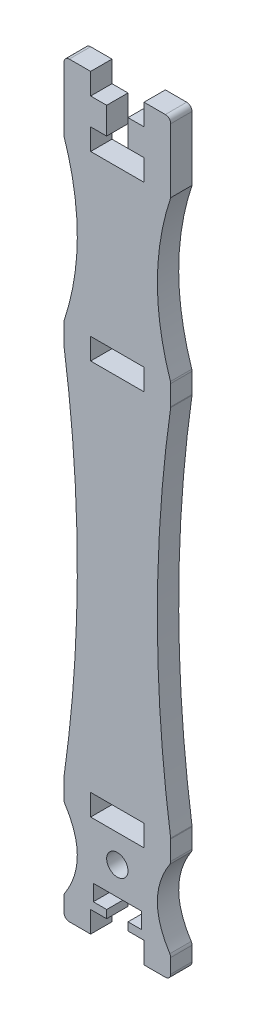
from build123d import *

# Parameters (mm, degrees)
CROQUIS1_W              = 10
CROQUIS1_H              = 4
CROQUIS1_R              = 2
SALIENTE_EXTRUIR1_DEPTH = 4


with BuildPart() as part:
    # Croquis1 → Saliente-Extruir1 (new body)
    with BuildSketch(Plane.XY):
        with BuildLine():
            Line((-14, -70), (-10, -70))
            Line((-10, -70), (-10, -66))
            Line((-10, -66), (-7, -66))
            Line((-7, -66), (-7, -64.5))
            Line((-7, -64.5), (-9.5, -64.5))
            Line((-9.5, -64.5), (-9.5, -61.5))
            Line((-9.5, -61.5), (-0.5, -61.5))
            Line((-0.5, -61.5), (-0.5, -64.5))
            Line((-0.5, -64.5), (-3, -64.5))
            Line((-3, -64.5), (-3, -66))
            Line((-3, -66), (0, -66))
            Line((0, -66), (0, -70))
            Line((0, -70), (4, -70))
            ThreePointArc((4, -70), (4.707106781, -69.707106781), (5, -69))
            Line((5, -69), (5, -66.298618771))
            ThreePointArc((5, -66.298618771), (4.959256868, -66.016083354), (4.840347477, -65.756570693))
            add(Edge.make_bspline(
                [(4.840347477, -65.756570693), (3.280115826, -63.337713796), (1.719884174, -58.5), (3.280115826, -53.662286204), (4.840347477, -51.243429307)],
                knots=[0.01622862, 0.01622862, 0.01622862, 0.01622862, 0.5, 0.98377138, 0.98377138, 0.98377138, 0.98377138], degree=3))
            ThreePointArc((4.840347477, -51.243429307), (4.959256868, -50.983916646), (5, -50.701381229))
            Line((5, -50.701381229), (5, -47.070997241))
            ThreePointArc((5, -47.070997241), (4.997494145, -47.000248166), (4.989989137, -46.929853666))
            add(Edge.make_bspline(
                [(4.989989137, -46.929853666), (3.329996379, -35.286569111), (1.670003621, -12), (3.329996379, 11.286569111), (4.989989137, 22.929853666)],
                knots=[0.00100209, 0.00100209, 0.00100209, 0.00100209, 0.5, 0.99899791, 0.99899791, 0.99899791, 0.99899791], degree=3))
            ThreePointArc((4.989989137, 22.929853666), (4.997494145, 23.000248166), (5, 23.070997241))
            Line((5, 23.070997241), (5, 26.838505544))
            ThreePointArc((5, 26.838505544), (4.987329796, 26.997187218), (4.949640253, 27.151847833))
            add(Edge.make_bspline(
                [(4.949640253, 27.151847833), (1.666752066, 37.101231889), (1.683538525, 47.056062614), (5, 57)],
                knots=[0.005061594, 0.005061594, 0.005061594, 0.005061594, 1, 1, 1, 1], degree=3))
            Line((5, 57), (5, 69))
            ThreePointArc((5, 69), (4.707106781, 69.707106781), (4, 70))
            Line((4, 70), (0, 70))
            Line((0, 70), (0, 66))
            Line((0, 66), (-3, 66))
            Line((-3, 66), (-3, 61))
            Line((-3, 61), (0, 61))
            Line((0, 61), (0, 57))
            Line((0, 57), (-10, 57))
            Line((-10, 57), (-10, 61))
            Line((-10, 61), (-7, 61))
            Line((-7, 61), (-7, 66))
            Line((-7, 66), (-10, 66))
            Line((-10, 66), (-10, 70))
            Line((-10, 70), (-14, 70))
            ThreePointArc((-14, 70), (-14.707106781, 69.707106781), (-15, 69))
            Line((-15, 69), (-15, 57))
            add(Edge.make_bspline(
                [(-14.949640253, 27.151847833), (-11.666752066, 37.101231889), (-11.683538525, 47.056062614), (-15, 57)],
                knots=[0.005061594, 0.005061594, 0.005061594, 0.005061594, 1, 1, 1, 1], degree=3))
            ThreePointArc((-14.949640253, 27.151847833), (-14.987329796, 26.997187218), (-15, 26.838505544))
            Line((-15, 26.838505544), (-15, 23.070997241))
            ThreePointArc((-15, 23.070997241), (-14.997494145, 23.000248166), (-14.989989137, 22.929853666))
            add(Edge.make_bspline(
                [(-14.989989137, -46.929853666), (-13.329996379, -35.286569111), (-11.670003621, -12), (-13.329996379, 11.286569111), (-14.989989137, 22.929853666)],
                knots=[0.00100209, 0.00100209, 0.00100209, 0.00100209, 0.5, 0.99899791, 0.99899791, 0.99899791, 0.99899791], degree=3))
            ThreePointArc((-14.989989137, -46.929853666), (-14.997494145, -47.000248166), (-15, -47.070997241))
            Line((-15, -47.070997241), (-15, -50.701381229))
            ThreePointArc((-15, -50.701381229), (-14.959256868, -50.983916646), (-14.840347477, -51.243429307))
            add(Edge.make_bspline(
                [(-14.840347477, -51.243429307), (-13.280115826, -53.662286204), (-11.719884174, -58.5), (-13.280115826, -63.337713796), (-14.840347477, -65.756570693)],
                knots=[0.01622862, 0.01622862, 0.01622862, 0.01622862, 0.5, 0.98377138, 0.98377138, 0.98377138, 0.98377138], degree=3))
            ThreePointArc((-14.840347477, -65.756570693), (-14.959256868, -66.016083354), (-15, -66.298618771))
            Line((-15, -66.298618771), (-15, -69))
            ThreePointArc((-15, -69), (-14.707106781, -69.707106781), (-14, -70))
        make_face()
        with Locations((-5, 25)):
            Rectangle(CROQUIS1_W, CROQUIS1_H, mode=Mode.SUBTRACT)
        with Locations((-5, -49)):
            Rectangle(CROQUIS1_W, CROQUIS1_H, mode=Mode.SUBTRACT)
        with Locations((-5, -56.25)):
            Circle(CROQUIS1_R, mode=Mode.SUBTRACT)
    extrude(amount=SALIENTE_EXTRUIR1_DEPTH)


solid = part.part
